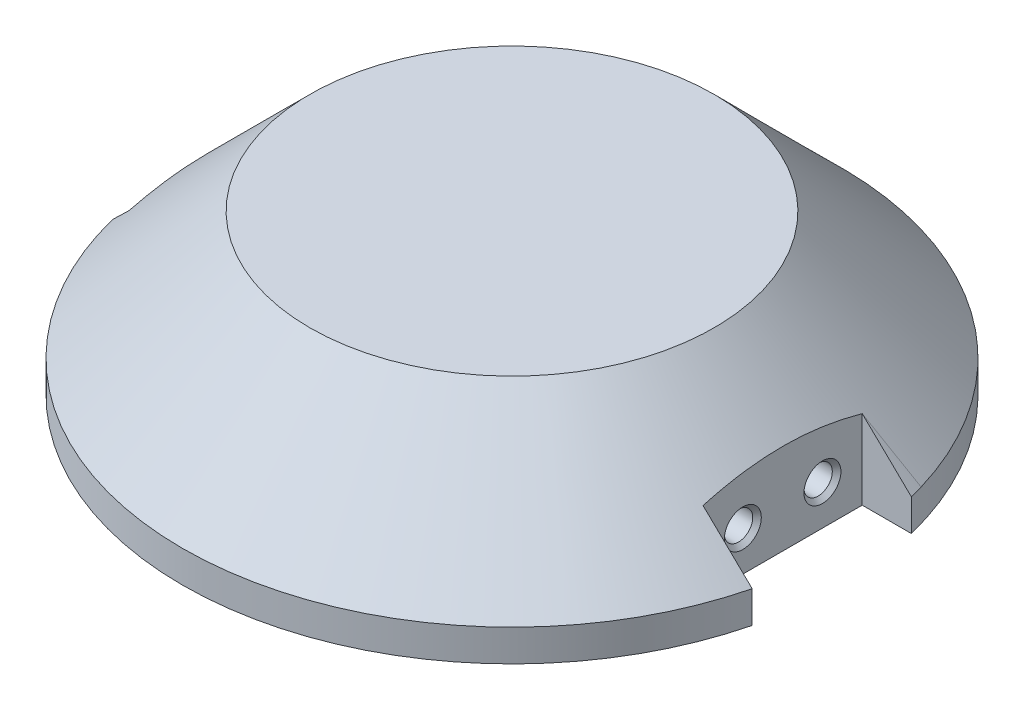
from build123d import *

# Parameters (mm, degrees)
SKETCH5_W                       = 2.0828
SKETCH5_H                       = 12.7
CUT_EXTRUDE1_DEPTH              = 40.287568543
F_4_40_TAPPED_HOLE1_D           = 2.2606
F_4_40_TAPPED_HOLE1_DEPTH       = 7.5946
F_4_40_TAPPED_HOLE1_CSINK_D     = 2.9464
F_4_40_TAPPED_HOLE1_CSINK_ANGLE = 90
F_4_40_TAPPED_HOLE1_TIP         = 0.679152758
SKETCH13_W                      = 12.7
SKETCH13_H                      = 10.16
CUT_EXTRUDE3_DEPTH              = 56.415385215
F_4_40_TAPPED_HOLE2_D           = 2.2606
F_4_40_TAPPED_HOLE2_DEPTH       = 7.5946
F_4_40_TAPPED_HOLE2_CSINK_D     = 2.9464
F_4_40_TAPPED_HOLE2_CSINK_ANGLE = 90
F_4_40_TAPPED_HOLE2_TIP         = 0.679152758


with BuildPart() as part:
    # Sketch3 → Revolve2 (revolve)
    with BuildSketch(Plane.XY, mode=Mode.PRIVATE) as revolve2_sk:
        Polygon((0, 0), (28.829, 0), (16.129, 12.7), (0, 12.7), align=None)
    revolve(revolve2_sk.sketch.rotate(Axis((0, 12.7, 0), (0, -1, 0)), 90), axis=Axis((0, 12.7, 0), (0, -1, 0)))

    # Sketch4 → Cut-Revolve1 (revolve, cut)
    with BuildSketch(Plane.XY, mode=Mode.PRIVATE) as cut_revolve1_sk:
        Polygon((26.289, 0), (26.289, 2.54), (32.114429802, 2.54), (32.114429802, -2.248824617), (26.289, -2.248824617), align=None)
    revolve(cut_revolve1_sk.sketch.rotate(Axis((0, 0, 0), (0, 1, 0)), 90), axis=Axis((0, 0, 0), (0, 1, 0)), mode=Mode.SUBTRACT)

    # Sketch5 → Cut-Extrude1 (cut, through all)
    with BuildSketch(Plane.XZ):
        with Locations((-25.2476, 0)):
            Rectangle(SKETCH5_W, SKETCH5_H)
    extrude(amount=-CUT_EXTRUDE1_DEPTH, mode=Mode.SUBTRACT)

    # #4-40 Tapped Hole1
    with Locations(Plane.ZY.offset(24.2062)):
        with Locations((-3.175, 1.8034), (3.175, 1.8034)):
            CounterSinkHole(F_4_40_TAPPED_HOLE1_D / 2, F_4_40_TAPPED_HOLE1_CSINK_D / 2, depth=F_4_40_TAPPED_HOLE1_DEPTH, counter_sink_angle=F_4_40_TAPPED_HOLE1_CSINK_ANGLE)
            with Locations((0, 0, -(F_4_40_TAPPED_HOLE1_DEPTH + F_4_40_TAPPED_HOLE1_TIP / 2))):  # 118° drill point
                Cone(0, F_4_40_TAPPED_HOLE1_D / 2, F_4_40_TAPPED_HOLE1_TIP, mode=Mode.SUBTRACT)

    # Sketch13 → Cut-Extrude3 (cut, through all)
    with BuildSketch(Plane.ZY.offset(-21.59)):
        with Locations((0, 5.08)):
            Rectangle(SKETCH13_W, SKETCH13_H)
    extrude(amount=-CUT_EXTRUDE3_DEPTH, mode=Mode.SUBTRACT)

    # #4-40 Tapped Hole2
    with Locations(Plane(origin=(21.59, 0, 0), x_dir=(0, 0, -1), z_dir=(1, 0, 0))):
        with Locations((-3.175, 3.175), (3.175, 3.175)):
            CounterSinkHole(F_4_40_TAPPED_HOLE2_D / 2, F_4_40_TAPPED_HOLE2_CSINK_D / 2, depth=F_4_40_TAPPED_HOLE2_DEPTH, counter_sink_angle=F_4_40_TAPPED_HOLE2_CSINK_ANGLE)
            with Locations((0, 0, -(F_4_40_TAPPED_HOLE2_DEPTH + F_4_40_TAPPED_HOLE2_TIP / 2))):  # 118° drill point
                Cone(0, F_4_40_TAPPED_HOLE2_D / 2, F_4_40_TAPPED_HOLE2_TIP, mode=Mode.SUBTRACT)


solid = part.part
